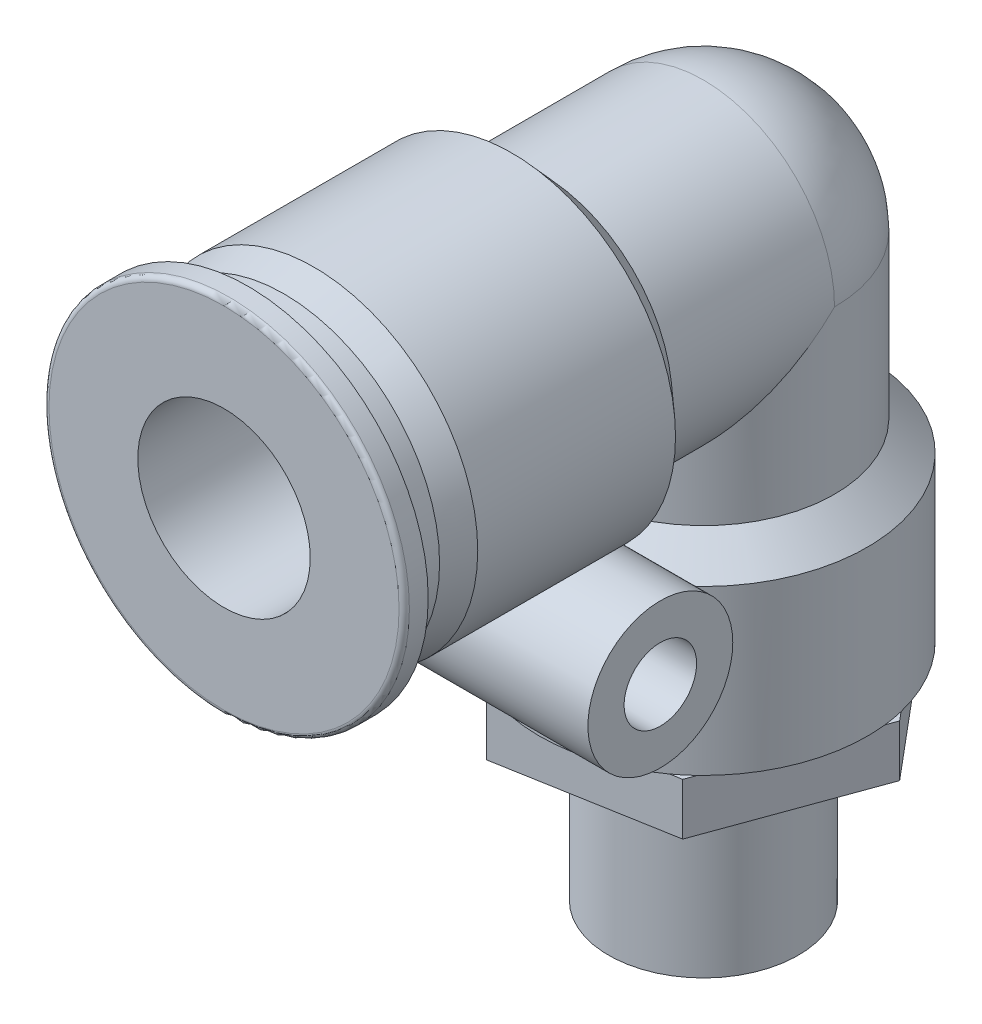
from build123d import *

# Parameters (mm, degrees)
SKETCH_3_R               = 5
CUT_EXTRUDE_1_DEPTH      = 27.8
EXTRUDE_1_DEPTH          = 9.5
EXTRUDE_1_DEPTH_BACK     = 9.5
SKETCH_5_R               = 4.2
CUT_EXTRUDE_2_DEPTH      = 9.5
CUT_EXTRUDE_2_DEPTH_BACK = 9.5
SKETCH_6_R               = 2.1
EXTRUDE_START            = 3
SKETCH_7_R               = 5
EXTRUDE_2_DEPTH          = 3
EXTRUDE_START_2          = 10
SKETCH_8_R               = 5.5
SKETCH_8_R_2             = 5
EXTRUDE_3_DEPTH          = 10


with BuildPart() as part:
    # 草图1 → 旋转1 (revolve)
    with BuildSketch(Plane(origin=(0, 0, 0), x_dir=(0, 0, -1), z_dir=(1, 0, 0))):
        with BuildLine():
            Line((-27.8, 0), (-27.8, 10.15))
            ThreePointArc((-27.8, 10.15), (-27.712132034, 10.362132034), (-27.5, 10.45))
            Line((-27.5, 10.45), (-26.41, 10.45))
            Line((-26.41, 10.45), (-26.41, 7.5))
            Line((-26.41, 7.5), (-25.715, 7.5))
            Line((-25.715, 7.5), (-25.715, 8.825))
            ThreePointArc((-25.715, 8.825), (-25.656421356, 8.966421356), (-25.515, 9.025))
            Line((-25.515, 9.025), (-24.325, 9.025))
            Line((-24.325, 9.025), (-22.5875, 9.5))
            Line((-22.5875, 9.5), (-11.12, 9.5))
            Line((-11.12, 9.5), (-9.409232316, 7.6))
            Line((-9.409232316, 7.6), (0, 7.6))
            ThreePointArc((0, 7.6), (5.374011537, 5.374011537), (7.6, 0))
            Line((7.6, 0), (-27.8, 0))
        make_face()
    revolve(axis=Axis((0, 0, -7.6), (0, 0, 1)))

    # 草图2 → 旋转2 (revolve)
    with BuildSketch(Plane(origin=(0, 0, 0), x_dir=(0, 0, -1), z_dir=(1, 0, 0))):
        Polygon((-9.5, -20.608198383), (-9.5, -11.12), (-7.6, -9.409232316), (-7.6, 0), (0, 0), (0, -20.608198383), align=None)
    revolve(axis=Axis((0, 0, 0), (0, -1, 0)))

    # 草图3 → 切除-拉伸1 (cut)
    with BuildSketch(Plane.XY):
        Circle(SKETCH_3_R)
    extrude(amount=CUT_EXTRUDE_1_DEPTH, mode=Mode.SUBTRACT)

    # 草图4 → 切除-旋转1 (revolve, cut)
    with BuildSketch(Plane(origin=(0, 0, 0), x_dir=(0, 0, -1), z_dir=(1, 0, 0))):
        with BuildLine():
            Line((5, 0), (5, -27.8))
            Line((5, -27.8), (0, -27.8))
            Line((0, -27.8), (0, 5))
            ThreePointArc((0, 5), (3.535533906, 3.535533906), (5, 0))
        make_face()
    revolve(axis=Axis((0, -27.8, 0), (0, 1, 0)), mode=Mode.SUBTRACT)

    # 草图5 → 凸台-拉伸1 (add, two sides: drawn at the far end of the back side and taken through both)
    with BuildSketch(Plane(origin=(0, 0, 0), x_dir=(0, 0, -1), z_dir=(1, 0, 0)).offset(-EXTRUDE_1_DEPTH_BACK)):
        with Locations((-12, -12)):
            Circle(SKETCH_5_R)
    extrude(amount=EXTRUDE_1_DEPTH + EXTRUDE_1_DEPTH_BACK)

    # 草图6 → 切除-拉伸2 (cut, two sides: drawn at the far end of the back side and taken through both)
    with BuildSketch(Plane(origin=(0, 0, 0), x_dir=(0, 0, -1), z_dir=(1, 0, 0)).offset(-CUT_EXTRUDE_2_DEPTH_BACK)):
        with Locations((-12, -12)):
            Circle(SKETCH_6_R)
    extrude(amount=CUT_EXTRUDE_2_DEPTH + CUT_EXTRUDE_2_DEPTH_BACK, mode=Mode.SUBTRACT)

    # 草图7 → 凸台-拉伸2 (add)
    with BuildSketch(Plane.XZ.offset(20.608198383).offset(EXTRUDE_START)):
        Polygon((-6.312687887, -7.51553757), (3.352302515, -9.224716862), (9.664990403, -1.709179291), (6.312687887, 7.51553757), (-3.352302515, 9.224716862), (-9.664990403, 1.709179291), align=None)
        Circle(SKETCH_7_R, mode=Mode.SUBTRACT)
    extrude(amount=-EXTRUDE_2_DEPTH)

    # 草图8 → 凸台-拉伸3 (add)
    with BuildSketch(Plane.XZ.offset(23.608198383).offset(EXTRUDE_START_2)):
        Circle(SKETCH_8_R)
        Circle(SKETCH_8_R_2, mode=Mode.SUBTRACT)
    extrude(amount=-EXTRUDE_3_DEPTH)


solid = part.part
